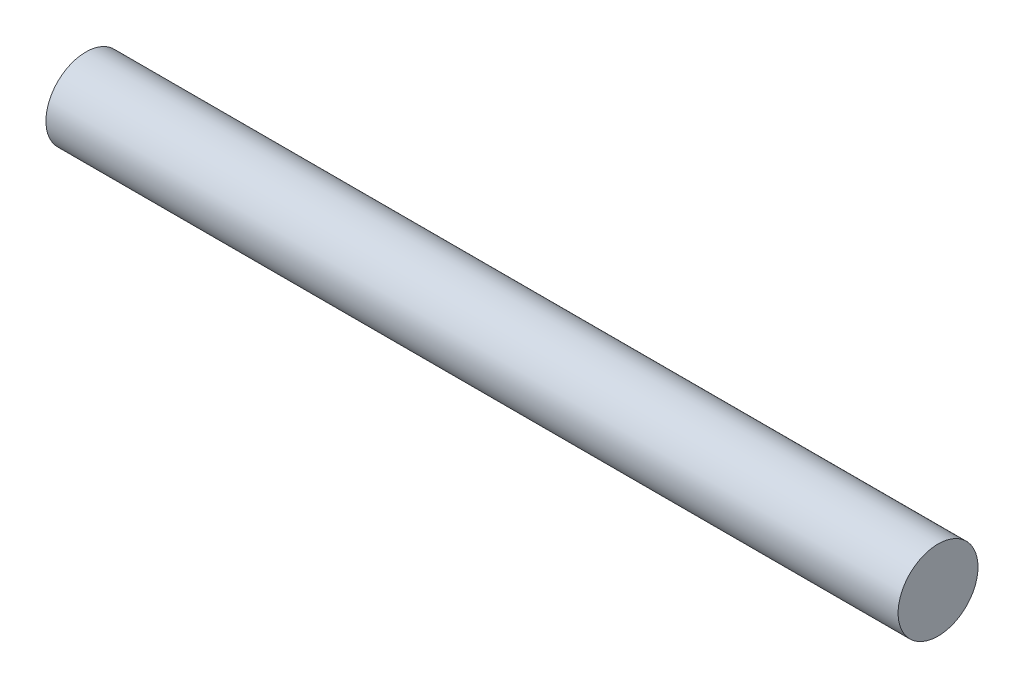
from build123d import *

# Parameters (mm, degrees)
SKETCH1_R           = 2.38125
BOSS_EXTRUDE1_DEPTH = 50.8


with BuildPart() as part:
    # Sketch1 → Boss-Extrude1 (new body)
    with BuildSketch(Plane(origin=(0, 0, 0), x_dir=(0, 0, -1), z_dir=(1, 0, 0))):
        Circle(SKETCH1_R)
    extrude(amount=BOSS_EXTRUDE1_DEPTH)


solid = part.part
